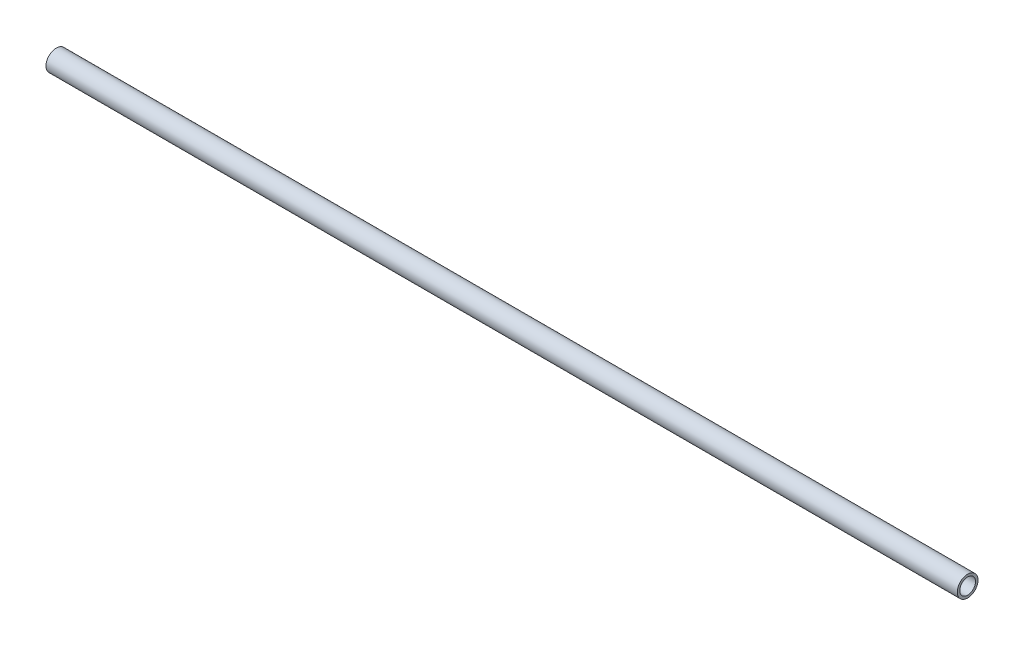
from build123d import *

# Parameters (mm, degrees)
SKETCH1_R           = 12.7
SKETCH1_R_2         = 9.652
BOSS_EXTRUDE1_DEPTH = 1117.6


with BuildPart() as part:
    # Sketch1 → Boss-Extrude1 (new body)
    with BuildSketch(Plane(origin=(0, 0, 0), x_dir=(0, 0, -1), z_dir=(1, 0, 0))):
        Circle(SKETCH1_R)
        Circle(SKETCH1_R_2, mode=Mode.SUBTRACT)
    extrude(amount=BOSS_EXTRUDE1_DEPTH)


solid = part.part
